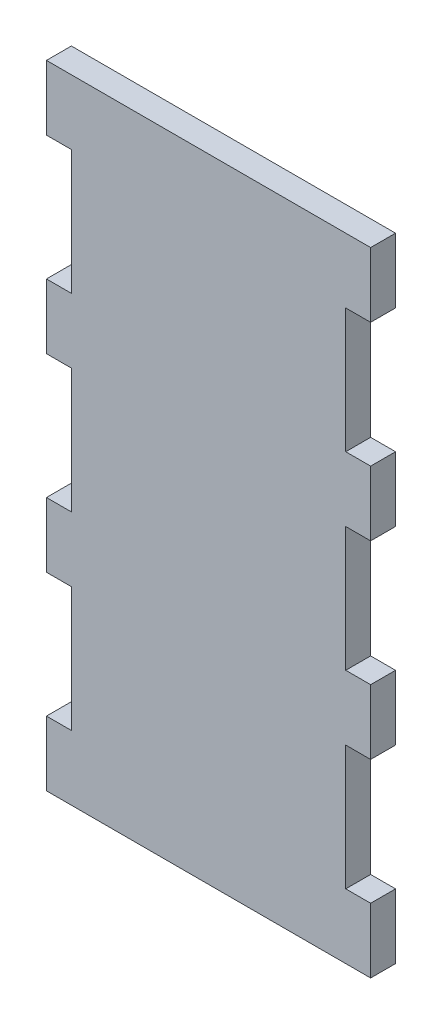
from build123d import *

# Parameters (mm, degrees)
SKETCH1_W           = 39.05
SKETCH1_H           = 76.2
BOSS_EXTRUDE1_DEPTH = 3
SKETCH2_W           = 3
SKETCH2_H           = 15
CUT_EXTRUDE1_DEPTH  = 73.446802019
LPATTERN1_COUNT     = 3
LPATTERN1_PITCH     = 22.8


with BuildPart() as part:
    # Sketch1 → Boss-Extrude1 (new body)
    with BuildSketch(Plane.XY):
        with Locations((-21.468460648, -21.557986111)):
            Rectangle(SKETCH1_W, SKETCH1_H)
    extrude(amount=BOSS_EXTRUDE1_DEPTH)

    # Sketch2 → Cut-Extrude1 (cut, through all)
    with BuildSketch(Plane.XY.offset(3)):
        with Locations((-39.493460648, 1.242013889)):
            Rectangle(SKETCH2_W, SKETCH2_H)
        with Locations((-3.443460648, 1.242013889)):
            Rectangle(SKETCH2_W, SKETCH2_H)
    cut_extrude1 = extrude(amount=-CUT_EXTRUDE1_DEPTH, mode=Mode.SUBTRACT)

    # LPattern1: Cut-Extrude1 ×3
    with Locations(*[(0, -i * LPATTERN1_PITCH, 0) for i in range(1, LPATTERN1_COUNT)]):
        add(cut_extrude1, mode=Mode.SUBTRACT)


solid = part.part
